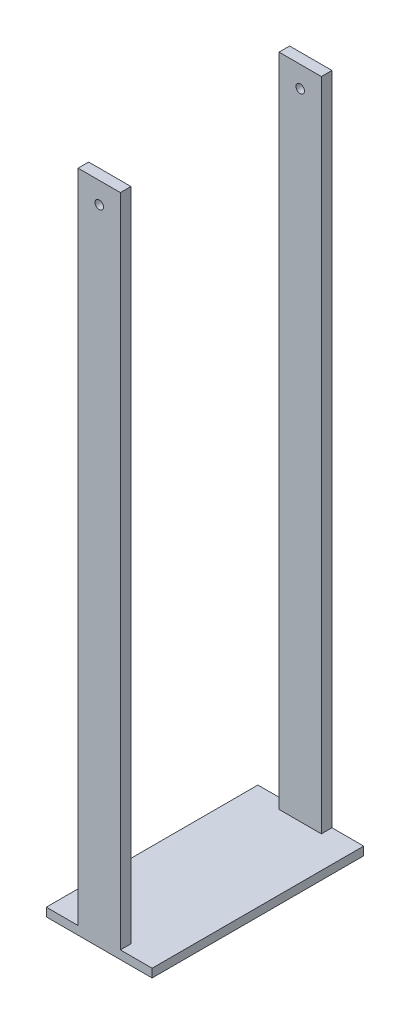
from build123d import *

# Parameters (mm, degrees)
SKETCH1_W          = 100
SKETCH1_H          = 8
EXTRUDE1_DEPTH     = 200
SKETCH4_W          = 40
SKETCH4_H          = 10
EXTRUDE3_DEPTH     = 620
SKETCH5_R          = 4
CUT_EXTRUDE2_DEPTH = 620


with BuildPart() as part:
    # Sketch1 → Extrude1 (new body)
    with BuildSketch(Plane.XY):
        with Locations((7.376785714, -69.436049107)):
            Rectangle(SKETCH1_W, SKETCH1_H)
    extrude(amount=EXTRUDE1_DEPTH)

    # Sketch4 → Extrude3 (add)
    with BuildSketch(Plane(origin=(0, -65.436049107, 0), x_dir=(1, 0, 0), z_dir=(0, 1, 0))):
        with Locations((7.376785714, -195)):
            Rectangle(SKETCH4_W, SKETCH4_H)
        with Locations((7.376785714, -5)):
            Rectangle(SKETCH4_W, SKETCH4_H)
    extrude(amount=EXTRUDE3_DEPTH)

    # Sketch5 → Cut-Extrude2 (cut)
    with BuildSketch(Plane.XY.offset(200)):
        with Locations((7.376785714, 534.563950893)):
            Circle(SKETCH5_R)
    extrude(amount=-CUT_EXTRUDE2_DEPTH, mode=Mode.SUBTRACT)


solid = part.part
